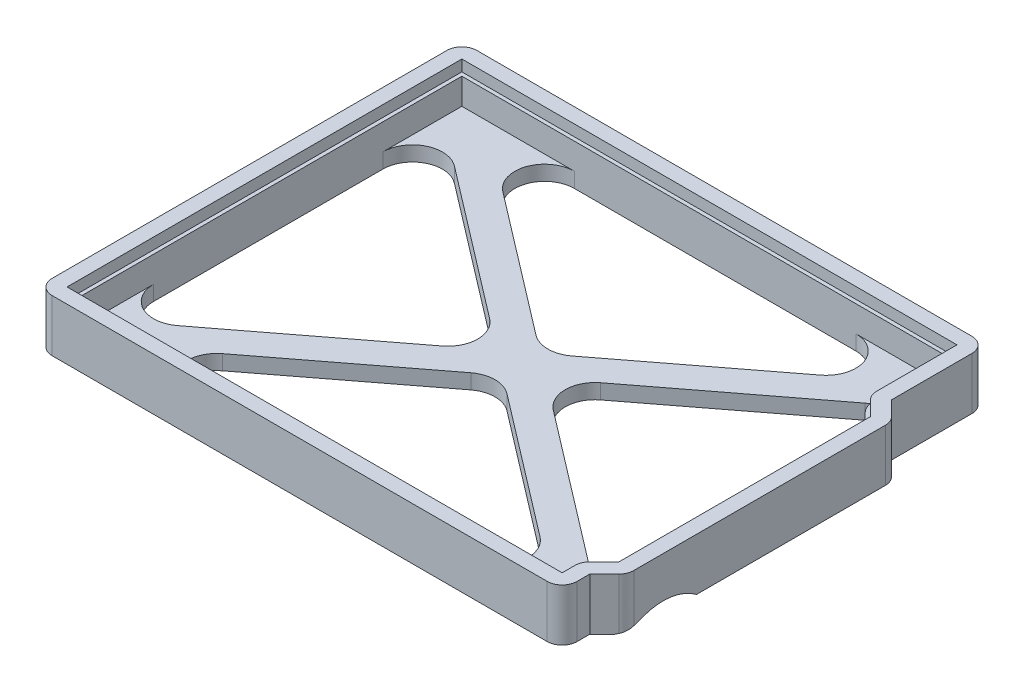
from build123d import *

# Parameters (mm, degrees)
EXTRUDE_1_DEPTH     = 2
EXTRUDE_2_DEPTH     = 7
EXTRUDE_3_DEPTH     = 5.5
FILLET_1_R          = 2
FILLET_2_R          = 2.5
CUT_EXTRUDE_1_DEPTH = 2.2
SKETCH_7_R          = 0.5
SKETCH_7_R_2        = 0.502126781
CUT_EXTRUDE_2_DEPTH = 0.5


with BuildPart() as part:
    # Эскиз1 → Бобышка-Вытянуть1 (new body)
    with BuildSketch(Plane(origin=(0, 0, 0), x_dir=(1, 0, 0), z_dir=(0, 1, 0))):
        Polygon((-36.5, 28.5), (-36.5, -28.5), (33.96, -28.5), (33.96, -24.788427125), (36.5, -22.248427125), (36.5, 13.174427125), (33.96, 15.714427125), (33.96, 28.5), align=None)
        with BuildLine():
            Line((18.891876357, -26), (-18.891876357, -26))
            ThreePointArc((-18.891876357, -26), (-22.680657515, -23.282629072), (-21.321676788, -18.822568668))
            Line((-21.321676788, -18.822568668), (-2.42980043, -4.375839689))
            ThreePointArc((-2.42980043, -4.375839689), (0, -3.553271021), (2.42980043, -4.375839689))
            Line((2.42980043, -4.375839689), (21.321676788, -18.822568668))
            ThreePointArc((21.321676788, -18.822568668), (22.680657515, -23.282629072), (18.891876357, -26))
        make_face(mode=Mode.SUBTRACT)
        with BuildLine():
            Line((34, 12.138893219), (34, -15.38790545))
            ThreePointArc((34, -15.38790545), (31.772117135, -18.973934014), (27.57019957, -18.565336782))
            Line((27.57019957, -18.565336782), (7.447553982, -3.177431332))
            ThreePointArc((7.447553982, -3.177431332), (5.877354412, 0), (7.447553982, 3.177431332))
            Line((7.447553982, 3.177431332), (27.57019957, 18.565336782))
            ThreePointArc((27.57019957, 18.565336782), (29.443384545, 19.348988538), (31.46, 19.111935525))
            Line((31.46, 19.111935525), (31.46, 14.678893219))
            Line((31.46, 14.678893219), (34, 12.138893219))
        make_face(mode=Mode.SUBTRACT)
        with BuildLine():
            Line((-18.891876357, 26), (18.891876357, 26))
            ThreePointArc((18.891876357, 26), (22.680657515, 23.282629072), (21.321676788, 18.822568668))
            Line((21.321676788, 18.822568668), (2.42980043, 4.375839689))
            ThreePointArc((2.42980043, 4.375839689), (0, 3.553271021), (-2.42980043, 4.375839689))
            Line((-2.42980043, 4.375839689), (-21.321676788, 18.822568668))
            ThreePointArc((-21.321676788, 18.822568668), (-22.680657515, 23.282629072), (-18.891876357, 26))
        make_face(mode=Mode.SUBTRACT)
        with BuildLine():
            Line((-34, -15.38790545), (-34, 15.38790545))
            ThreePointArc((-34, 15.38790545), (-31.772117135, 18.973934014), (-27.57019957, 18.565336782))
            Line((-27.57019957, 18.565336782), (-7.447553982, 3.177431332))
            ThreePointArc((-7.447553982, 3.177431332), (-5.877354412, 0), (-7.447553982, -3.177431332))
            Line((-7.447553982, -3.177431332), (-27.57019957, -18.565336782))
            ThreePointArc((-27.57019957, -18.565336782), (-31.772117135, -18.973934014), (-34, -15.38790545))
        make_face(mode=Mode.SUBTRACT)
    extrude(amount=EXTRUDE_1_DEPTH)

    # Эскиз5 → Бобышка-Вытянуть2 (add)
    with BuildSketch(Plane(origin=(0, 0, 0), x_dir=(1, 0, 0), z_dir=(0, 1, 0))):
        Polygon((33.96, -26.5), (33.96, -28.5), (-36.5, -28.5), (-36.5, 28.5), (31.96, 28.5), (33.96, 28.5), (33.96, 15.714427125), (36.5, 13.174427125), (36.5, -22.248427125), (33.96, -24.788427125), align=None)
        Polygon((31.96, -23.96), (34.5, -21.42), (34.5, 12.346), (31.96, 14.886), (31.96, 26.5), (-34.5, 26.5), (-34.5, -26.5), (31.96, -26.5), align=None, mode=Mode.SUBTRACT)
    extrude(amount=EXTRUDE_2_DEPTH)

    # Эскиз6 → Бобышка-Вытянуть3 (add)
    with BuildSketch(Plane(origin=(0, 0, 0), x_dir=(1, 0, 0), z_dir=(0, 1, 0))):
        Polygon((31.96, -23.96), (31.96, -26.5), (-34.5, -26.5), (-34.5, 26.5), (31.96, 26.5), (31.96, 14.886), (34.5, 12.346), (34.5, -21.42), align=None)
        Polygon((31.46, 26), (-34, 26), (-34, -26), (31.46, -26), (31.46, -23.96), (31.46, -23.752893219), (31.606446609, -23.606446609), (34, -21.212893219), (34, 12.138893219), (31.606446609, 14.532446609), (31.46, 14.678893219), (31.46, 14.886), align=None, mode=Mode.SUBTRACT)
    extrude(amount=EXTRUDE_3_DEPTH)

    # Скругление1
    fillet_1_edges = [part.edges().sort_by_distance(p)[0] for p in [
        (31.96, 6.25, 23.96),
        (31.96, 6.25, -14.886),
        (33.96, 3.5, 28.5),
        (-36.5, 3.5, 28.5),
        (-36.5, 3.5, -28.5),
        (33.96, 3.5, -28.5),
        (36.5, 3.5, -13.174427125),
        (36.5, 3.5, 22.248427125),
    ]]
    fillet(fillet_1_edges, radius=FILLET_1_R)

    # Скругление2
    fillet_2_edges = [part.edges().sort_by_distance(p)[0] for p in [
        (31.46, 3.75, 23.752893219),
        (31.46, 2.75, -14.678893219),
    ]]
    fillet(fillet_2_edges, radius=FILLET_2_R)

    # Эскиз4 → Вырез-Вытянуть1 (cut)
    with BuildSketch(Plane(origin=(36.5, 0, 0), x_dir=(0, 0, -1), z_dir=(1, 0, 0))):
        with BuildLine():
            Line((-23.080914643, 0), (-19.962989622, 1.084044193))
            ThreePointArc((-19.962989622, 1.084044193), (-16.346249259, 1.410725958), (-13, 0))
            Line((-13, 0), (-23.080914643, 0))
        make_face()
    cut_extrude_1 = extrude(amount=-CUT_EXTRUDE_1_DEPTH, mode=Mode.SUBTRACT)

    # Зеркальное отражение1: Вырез-Вытянуть1 across plane
    add(cut_extrude_1.mirror(Plane(origin=(0, 0, 0), x_dir=(0, 0, 1), z_dir=(1, 0, 0))), mode=Mode.SUBTRACT)

    # Эскиз7 → Вырез-Вытянуть2 (cut)
    with BuildSketch(Plane.XZ):
        with Locations(Location((14.24363767, 9.937218253, 0), (0, 0, 270))):
            Circle(SKETCH_7_R)
        with Locations(Location((23.6, -26.1, 0), (0, 0, 270))):
            Circle(SKETCH_7_R)
        with Locations(Location((-14.24363767, 9.937218253, 0), (0, 0, 270))):
            Circle(SKETCH_7_R)
        with Locations(Location((-23.6, -26.1, 0), (0, 0, 270))):
            Circle(SKETCH_7_R_2)
    extrude(amount=-CUT_EXTRUDE_2_DEPTH, mode=Mode.SUBTRACT)


solid = part.part
